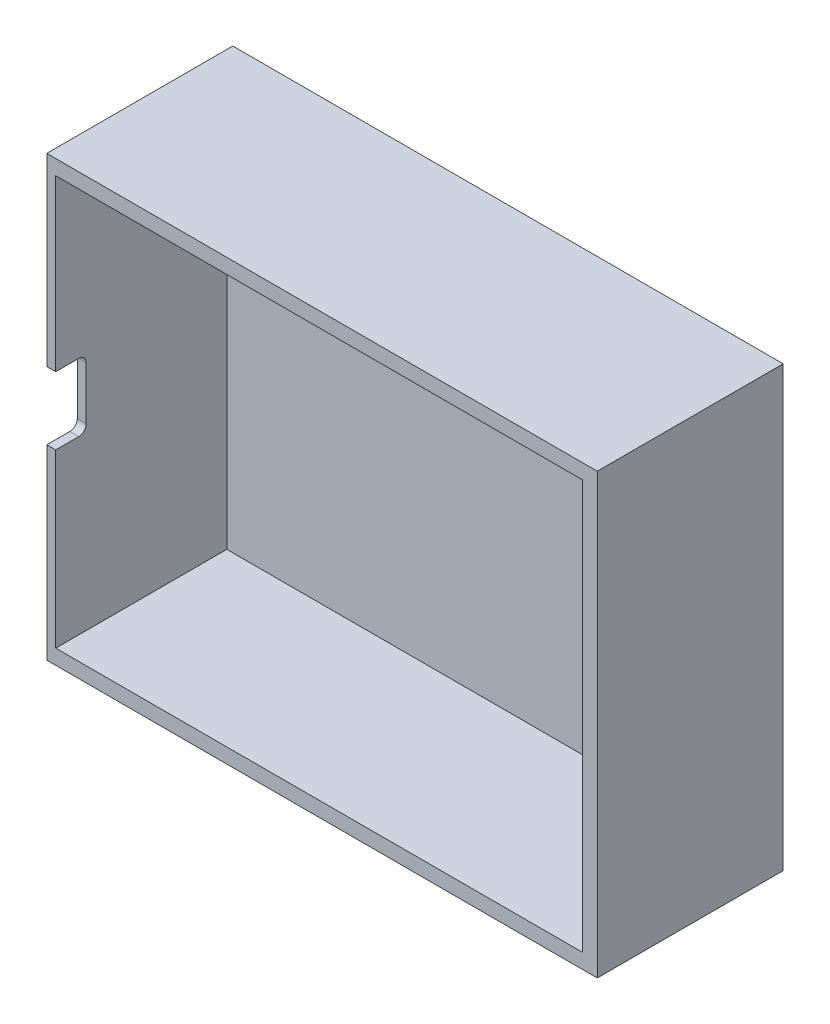
from build123d import *

# Parameters (mm, degrees)
CROQUIS1_W                  = 74
CROQUIS1_H                  = 59
SALIENTE_EXTRUIR1_DEPTH     = 25
VACIADO1_T                  = -2
VACIADO1_THICKNESS_2_FACE_W = 23
VACIADO1_THICKNESS_2_FACE_H = 55
VACIADO1_THICKNESS_2_DEPTH  = 0.8
CORTAR_EXTRUIR1_DEPTH       = 1.2


with BuildPart() as part:
    # Croquis1 → Saliente-Extruir1 (new body)
    with BuildSketch(Plane.XY):
        with Locations((627.712029931, -11.748201439)):
            Rectangle(CROQUIS1_W, CROQUIS1_H)
    extrude(amount=SALIENTE_EXTRUIR1_DEPTH)

    # Vaciado1
    vaciado1_openings = [part.faces().sort_by_distance(p)[0] for p in [
        (627.712029931, -11.748201439, 25),
    ]]
    offset(amount=VACIADO1_T, openings=vaciado1_openings, kind=Kind.INTERSECTION)

    # Vaciado1 thickness 2 face (on inner face of the shell) → Vaciado1 thickness 2 (cut)
    with BuildSketch(Plane(origin=(592.712029931, -11.748201439, 13.5), x_dir=(0, 0, -1), z_dir=(-1, 0, 0))):
        Rectangle(VACIADO1_THICKNESS_2_FACE_W, VACIADO1_THICKNESS_2_FACE_H)
    extrude(amount=VACIADO1_THICKNESS_2_DEPTH, mode=Mode.SUBTRACT)

    # Croquis2 → Cortar-Extruir1 (cut)
    with BuildSketch(Plane.ZY.offset(-590.712029931)):
        with BuildLine():
            Line((21.9, -7.072321113), (25, -7.072321113))
            Line((25, -7.072321113), (25, -16.172321113))
            Line((25, -16.172321113), (21.9, -16.172321113))
            ThreePointArc((21.9, -16.172321113), (21.192893219, -15.879427895), (20.9, -15.172321113))
            Line((20.9, -15.172321113), (20.9, -8.072321113))
            ThreePointArc((20.9, -8.072321113), (21.192893219, -7.365214332), (21.9, -7.072321113))
        make_face()
    extrude(amount=-CORTAR_EXTRUIR1_DEPTH, mode=Mode.SUBTRACT)


solid = part.part
